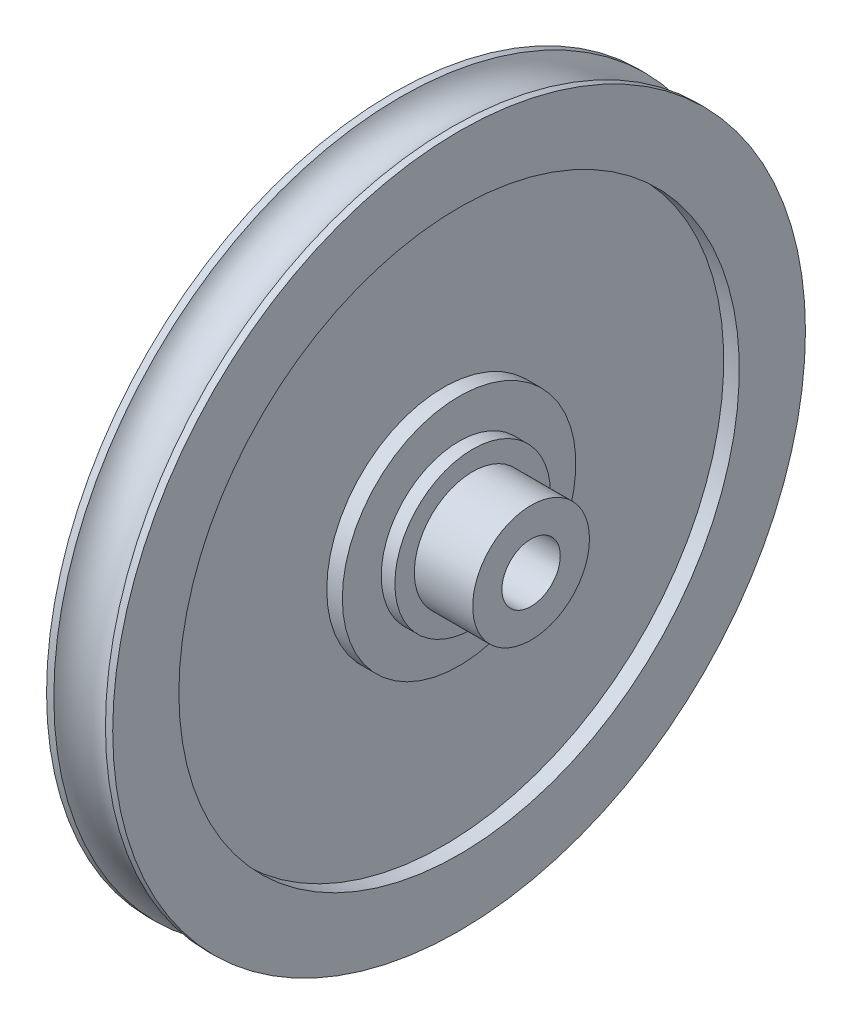
from build123d import *

# Parameters (mm, degrees)
AXE_DEPTH                   = 5.4
AXE_DEPTH_BACK              = 5.4
ESQUISSE4_R                 = 3
ESQUISSE6_R                 = 4
EMPAULEMENT_ROULEMENT_DEPTH = 0.7
AXE_3MM_DEPTH               = 27.714415584
AXE_3MM_DEPTH_BACK          = 27.714415584
ESQUISSE5_R                 = 1.5
ESQUISSE7_W                 = 4.96410879
ESQUISSE7_H                 = 0.7


with BuildPart() as part:
    # Esquisse2 → Révolution1 (revolve)
    with BuildSketch(Plane.XY, mode=Mode.PRIVATE) as r_volution1_sk:
        with BuildLine():
            ThreePointArc((1.5, 18.5), (0, 17), (-1.5, 18.5))
            Line((-1.5, 18.5), (-1.7, 18.5))
            Line((-1.7, 18.5), (-1.7, 0))
            Line((-1.7, 0), (1.7, 0))
            Line((1.7, 0), (1.7, 6))
            Line((1.7, 6), (0.9, 6))
            Line((0.9, 6), (0.9, 14.4))
            Line((0.9, 14.4), (1.7, 14.4))
            Line((1.7, 14.4), (1.7, 18.5))
            Line((1.7, 18.5), (1.5, 18.5))
        make_face()
    revolve(r_volution1_sk.sketch.rotate(Axis((-1.7, 0, 0), (1, 0, 0)), 90), axis=Axis((-1.7, 0, 0), (1, 0, 0)))

    # Esquisse4 → axe (add, two sides: drawn at the far end of the back side and taken through both)
    with BuildSketch(Plane(origin=(0, 0, 0), x_dir=(0, 0, -1), z_dir=(1, 0, 0)).offset(-AXE_DEPTH_BACK)):
        Circle(ESQUISSE4_R)
    extrude(amount=AXE_DEPTH + AXE_DEPTH_BACK)

    # Esquisse6 → empaulement_roulement (add)
    with BuildSketch(Plane(origin=(1.7, 0, 0), x_dir=(0, 0, -1), z_dir=(1, 0, 0))):
        with Locations(Location((0, 0, 0), (0, 0, 180))):
            Circle(ESQUISSE6_R)
    empaulement_roulement = extrude(amount=EMPAULEMENT_ROULEMENT_DEPTH)

    # Symétrie1: empaulement_roulement across plane
    add(empaulement_roulement.mirror(Plane(origin=(0, 0, 0), x_dir=(0, 0, 1), z_dir=(1, 0, 0))))

    # Esquisse5 → axe_3mm (cut, two sides: drawn at the far end of the back side and taken through both)
    with BuildSketch(Plane(origin=(0, 0, 0), x_dir=(0, 0, -1), z_dir=(1, 0, 0)).offset(-AXE_3MM_DEPTH_BACK)):
        Circle(ESQUISSE5_R)
    extrude(amount=AXE_3MM_DEPTH + AXE_3MM_DEPTH_BACK, mode=Mode.SUBTRACT)

    # Esquisse7 → Enlèvement de matière-Révolution1 (revolve, cut)
    with BuildSketch(Plane.XY, mode=Mode.PRIVATE) as enl_vement_de_mati_re_r_volution1_sk:
        with Locations((0, 18.15)):
            Rectangle(ESQUISSE7_W, ESQUISSE7_H)
    revolve(enl_vement_de_mati_re_r_volution1_sk.sketch.rotate(Axis((0, 0, 0), (1, 0, 0)), 270), axis=Axis((0, 0, 0), (1, 0, 0)), mode=Mode.SUBTRACT)


solid = part.part
